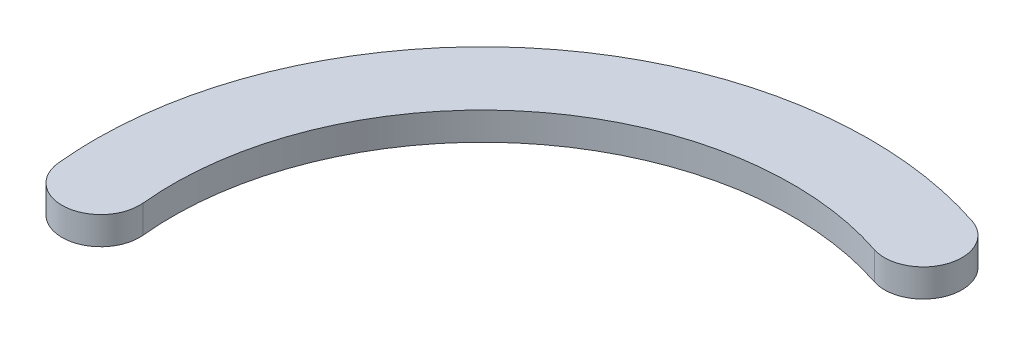
from build123d import *

# Parameters (mm, degrees)
BOSS_EXTRUDE1_DEPTH = 4.5


with BuildPart() as part:
    # Sketch1 → Boss-Extrude1 (new body)
    with BuildSketch(Plane(origin=(0, 0, 0), x_dir=(1, 0, 0), z_dir=(0, 1, 0))):
        with BuildLine():
            ThreePointArc((49.337283378, 33.664624618), (-9.403310394, 23.106193098), (-32.503489047, -31.923976619))
            ThreePointArc((-32.503489047, -31.923976619), (-25.65895387, -37.516591231), (-20.066339257, -30.672056053))
            ThreePointArc((-20.066339257, -30.672056053), (-1.586196335, 13.35207972), (45.406278683, 21.798824936))
            ThreePointArc((45.406278683, 21.798824936), (53.304680871, 25.766222429), (49.337283378, 33.664624618))
        make_face()
    extrude(amount=BOSS_EXTRUDE1_DEPTH)


solid = part.part
